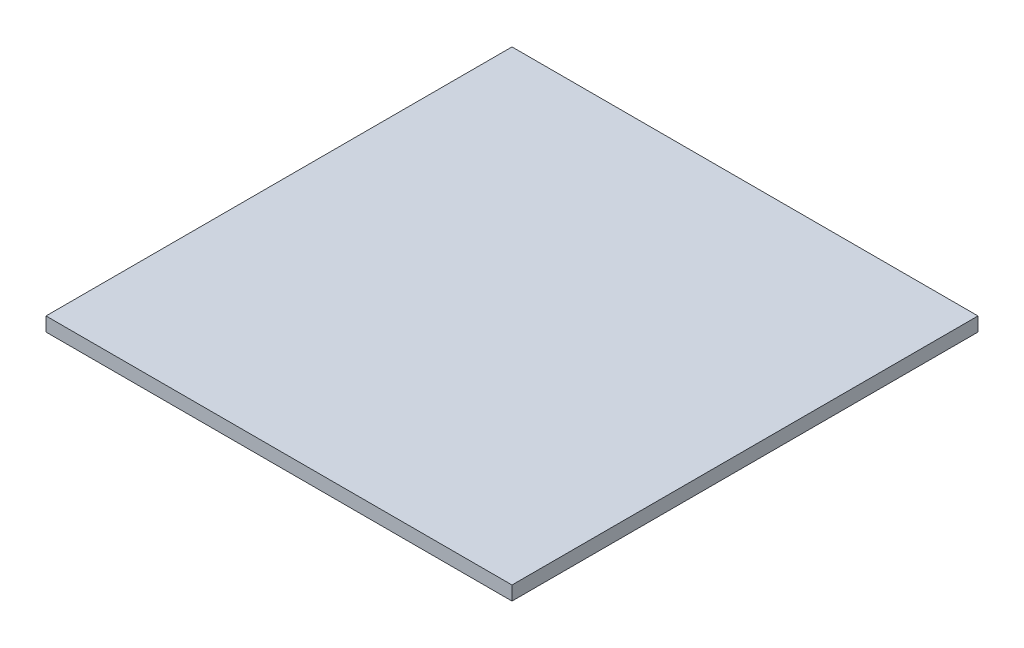
from build123d import *

# Parameters (mm, degrees)
SKETCH3_W           = 100
SKETCH3_H           = 100
BOSS_EXTRUDE3_DEPTH = 3


with BuildPart() as part:
    # Sketch3 → Boss-Extrude3 (new body)
    with BuildSketch(Plane(origin=(0, 0, 0), x_dir=(1, 0, 0), z_dir=(0, 1, 0))):
        Rectangle(SKETCH3_W, SKETCH3_H)
    extrude(amount=BOSS_EXTRUDE3_DEPTH)


solid = part.part
